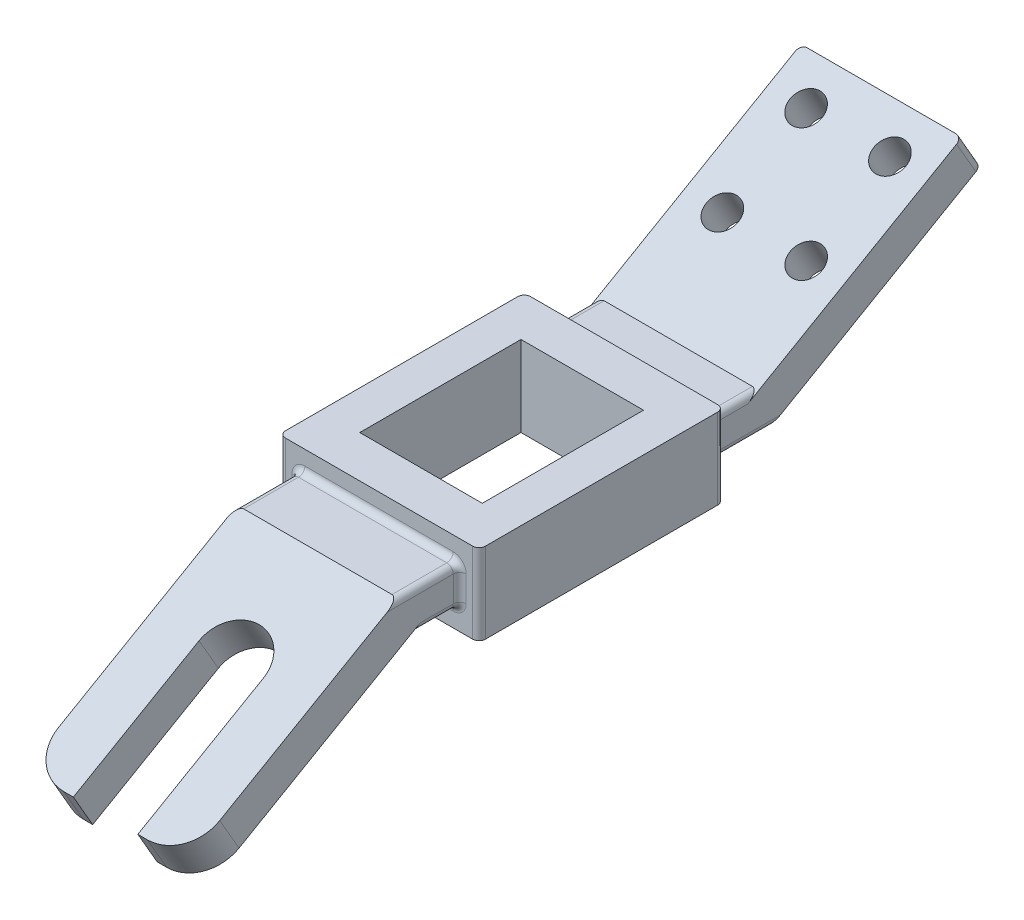
from build123d import *

# Parameters (mm, degrees)
SKETCH_1_W          = 62
SKETCH_1_H          = 76
SKETCH_1_W_2        = 38
SKETCH_1_H_2        = 50
EXTRUDE_1_DEPTH     = 12.5
EXTRUDE_2_DEPTH     = 25
SKETCH_3_R          = 5
CUT_EXTRUDE_3_DEPTH = 151.634898624
CUT_EXTRUDE_4_DEPTH = 161.843921561
FILLET_1_R          = 12
FILLET_2_R          = 2
FILLET_3_R          = 2


with BuildPart() as part:
    # 草圖1 → 伸長1 (new, symmetric)
    with BuildSketch(Plane(origin=(0, 0, 0), x_dir=(1, 0, 0), z_dir=(0, 1, 0))):
        Rectangle(SKETCH_1_W, SKETCH_1_H)
        Rectangle(SKETCH_1_W_2, SKETCH_1_H_2, mode=Mode.SUBTRACT)
    extrude(amount=EXTRUDE_1_DEPTH, both=True)

    # 草圖2 → 伸長2 (add, symmetric)
    with BuildSketch(Plane(origin=(0, 0, 0), x_dir=(0, 0, -1), z_dir=(1, 0, 0))):
        Polygon((38, 6), (54.784609691, 6), (117.817930688, 42.392304845), (123.817930688, 32), (58, -6), (38, -6), align=None)
        Polygon((-38, 6), (-57, 6), (-122.817930688, -32), (-116.817930688, -42.392304845), (-53.784609691, -6), (-38, -6), align=None)
    extrude(amount=EXTRUDE_2_DEPTH, both=True)

    # 草圖3 → 伸長3 (cut, through all)
    with BuildSketch(Plane(origin=(0, -19.222431864, -11.098076211), x_dir=(1, 0, 0), z_dir=(0, 0.8660254037844377, 0.5000000000000018))):
        with Locations(Location((-13, 111.229473419, 0), (0, 0, 270))):
            Circle(SKETCH_3_R)
        with Locations(Location((13, 111.229473419, 0), (0, 0, 270))):
            Circle(SKETCH_3_R)
        with Locations(Location((-13, 81.229473419, 0), (0, 0, 270))):
            Circle(SKETCH_3_R)
        with Locations(Location((13, 81.229473419, 0), (0, 0, 270))):
            Circle(SKETCH_3_R)
    extrude(amount=-CUT_EXTRUDE_3_DEPTH, mode=Mode.SUBTRACT)

    # 草圖4 → 伸長4 (cut, through all)
    with BuildSketch(Plane(origin=(0, 29.181724008, 16.848076211), x_dir=(1, 0, 0), z_dir=(0, 0.8660254037844377, 0.5000000000000014))):
        with BuildLine():
            Line((-10, -122.363448016), (-10, -77.363448016))
            ThreePointArc((-10, -77.363448016), (0, -67.363448016), (10, -77.363448016))
            Line((10, -77.363448016), (10, -122.363448016))
            Line((10, -122.363448016), (-10, -122.363448016))
        make_face()
    extrude(amount=-CUT_EXTRUDE_4_DEPTH, mode=Mode.SUBTRACT)

    # 圓角1
    fillet_1_edges = [part.edges().sort_by_distance(p)[0] for p in [
        (-25, -37.196152423, 119.817930688),
        (25, -37.196152423, 119.817930688),
    ]]
    fillet(fillet_1_edges, radius=FILLET_1_R)

    # 圓角2
    fillet_2_edges = [part.edges().sort_by_distance(p)[0] for p in [
        (-25, -6, -48),
        (-25, 37.196152423, -120.817930688),
        (-25, 6, -46.392304845),
        (25, -6, -48),
        (25, 37.196152423, -120.817930688),
        (25, 6, -46.392304845),
        (-25, 6, 47.5),
        (-25, -6, 45.892304845),
        (25, 6, 47.5),
        (25, -6, 45.892304845),
        (-31, 0, -38),
        (31, 0, -38),
        (31, 0, 38),
        (-31, 0, 38),
    ]]
    fillet(fillet_2_edges, radius=FILLET_2_R)

    # 圓角3
    fillet_3_edges = [part.edges().sort_by_distance(p)[0] for p in [
        (0, -6, -38),
        (-25, 0, -38),
        (0, 6, -38),
        (25, 0, -38),
        (0, -6, 38),
        (-25, 0, 38),
        (0, 6, 38),
        (25, 0, 38),
        (-24.414213562, -5.414213562, -38),
        (-24.414213562, 5.414213562, -38),
        (24.414213562, -5.414213562, -38),
        (24.414213562, 5.414213562, -38),
        (-24.414213562, -5.414213562, 38),
        (-24.414213562, 5.414213562, 38),
        (24.414213562, -5.414213562, 38),
        (24.414213562, 5.414213562, 38),
    ]]
    fillet(fillet_3_edges, radius=FILLET_3_R)


solid = part.part
